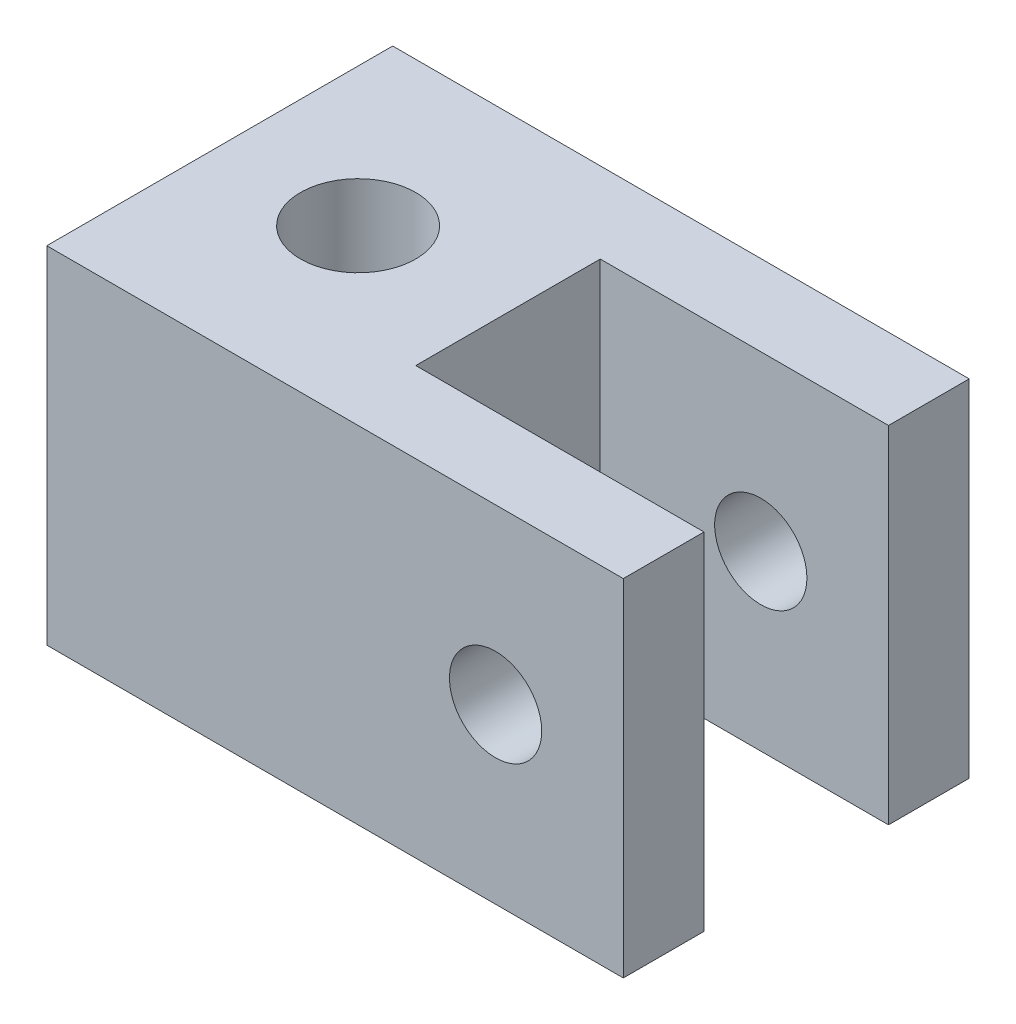
from build123d import *

# Parameters (mm, degrees)
CROQUIS1_W              = 15
CROQUIS1_H              = 15
SALIENTE_EXTRUIR1_DEPTH = 12.5
CROQUIS2_R              = 2.5
CROQUIS2_W              = 25
CROQUIS2_H              = 8
CORTAR_EXTRUIR1_DEPTH   = 21.916500663
CROQUIS3_R              = 2
CORTAR_EXTRUIR2_DEPTH   = 21.916500663


with BuildPart() as part:
    # Croquis1 → Saliente-Extruir1 (new, symmetric)
    with BuildSketch(Plane(origin=(0, 0, 0), x_dir=(0, 0, -1), z_dir=(1, 0, 0))):
        Rectangle(CROQUIS1_W, CROQUIS1_H)
    extrude(amount=SALIENTE_EXTRUIR1_DEPTH, both=True)

    # Croquis2 → Cortar-Extruir1 (cut, through all)
    with BuildSketch(Plane(origin=(0, 7.5, 0), x_dir=(1, 0, 0), z_dir=(0, 1, 0))):
        with Locations(Location((-6.5, 0, 0), (0, 0, 270))):
            Circle(CROQUIS2_R)
        with Locations((12.5, 0)):
            Rectangle(CROQUIS2_W, CROQUIS2_H)
    extrude(amount=-CORTAR_EXTRUIR1_DEPTH, mode=Mode.SUBTRACT)

    # Croquis3 → Cortar-Extruir2 (cut, through all)
    with BuildSketch(Plane.XY.offset(7.5)):
        with Locations((6.961549082, 0)):
            Circle(CROQUIS3_R)
    extrude(amount=-CORTAR_EXTRUIR2_DEPTH, mode=Mode.SUBTRACT)


solid = part.part
